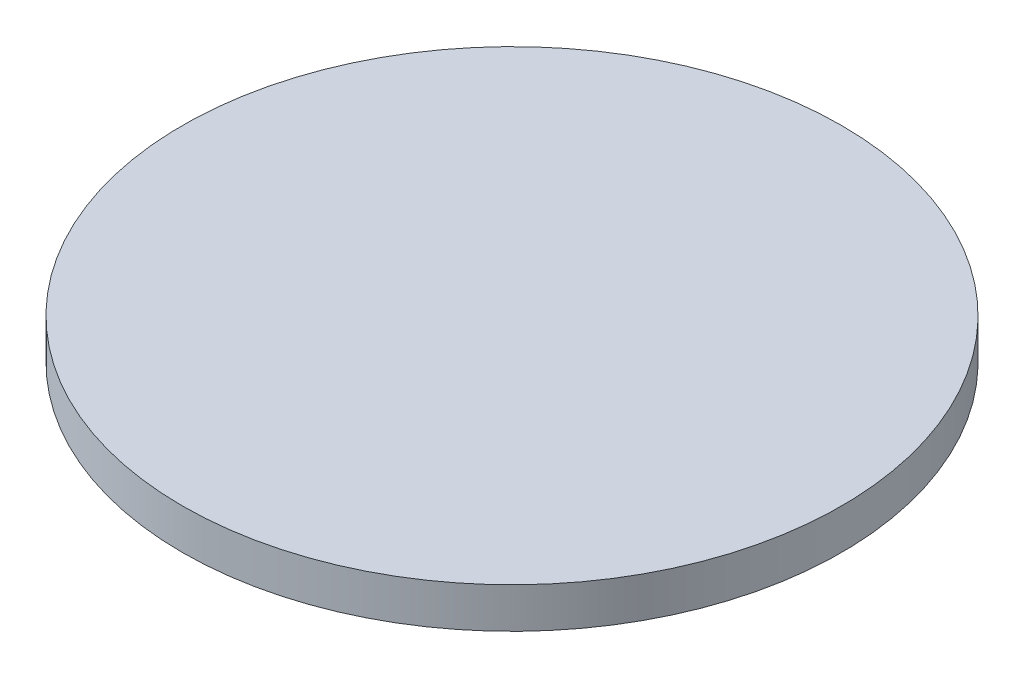
from build123d import *

# Parameters (mm, degrees)
SKETCH_1_R      = 24.5
EXTRUDE_1_DEPTH = 3


with BuildPart() as part:
    # Эскиз1 → Бобышка-Вытянуть1 (new body)
    with BuildSketch(Plane(origin=(0, 0, 0), x_dir=(1, 0, 0), z_dir=(0, 1, 0))):
        with Locations(Location((0, 0, 0), (0, 0, 270))):
            Circle(SKETCH_1_R)
    extrude(amount=EXTRUDE_1_DEPTH)


solid = part.part
